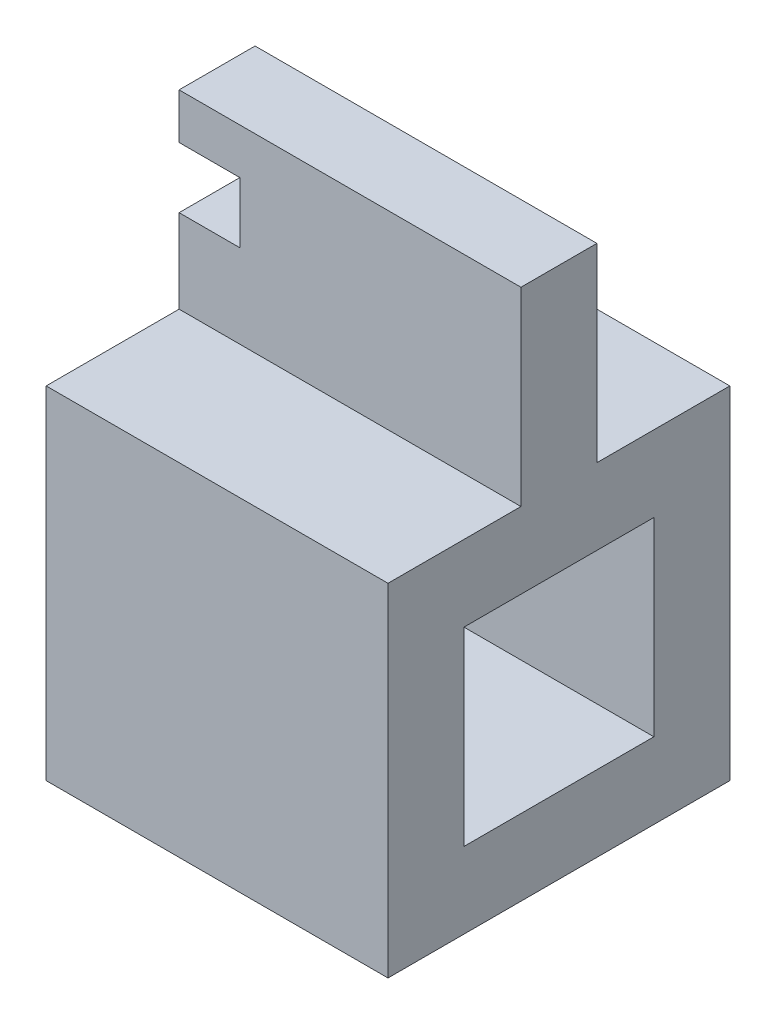
from build123d import *

# Parameters (mm, degrees)
SKETCH1_W           = 9
SKETCH1_H           = 9
SKETCH1_W_2         = 5
SKETCH1_H_2         = 5
BOSS_EXTRUDE1_DEPTH = 9
SKETCH2_W           = 9
SKETCH2_H           = 2
BOSS_EXTRUDE2_DEPTH = 5
SKETCH3_W           = 1.6
SKETCH3_H           = 1.6
CUT_EXTRUDE1_DEPTH  = 5


with BuildPart() as part:
    # Sketch1 → Boss-Extrude1 (new body)
    with BuildSketch(Plane(origin=(0, 0, 0), x_dir=(0, 0, -1), z_dir=(1, 0, 0))):
        Rectangle(SKETCH1_W, SKETCH1_H)
        Rectangle(SKETCH1_W_2, SKETCH1_H_2, mode=Mode.SUBTRACT)
    extrude(amount=BOSS_EXTRUDE1_DEPTH)

    # Sketch2 → Boss-Extrude2 (add)
    with BuildSketch(Plane(origin=(0, 4.5, 0), x_dir=(1, 0, 0), z_dir=(0, 1, 0))):
        with Locations((4.5, 0)):
            Rectangle(SKETCH2_W, SKETCH2_H)
    extrude(amount=BOSS_EXTRUDE2_DEPTH)

    # Sketch3 → Cut-Extrude1 (cut)
    with BuildSketch(Plane.XY.offset(1)):
        with Locations((0.8, 7.5)):
            Rectangle(SKETCH3_W, SKETCH3_H)
    extrude(amount=-CUT_EXTRUDE1_DEPTH, mode=Mode.SUBTRACT)


solid = part.part
